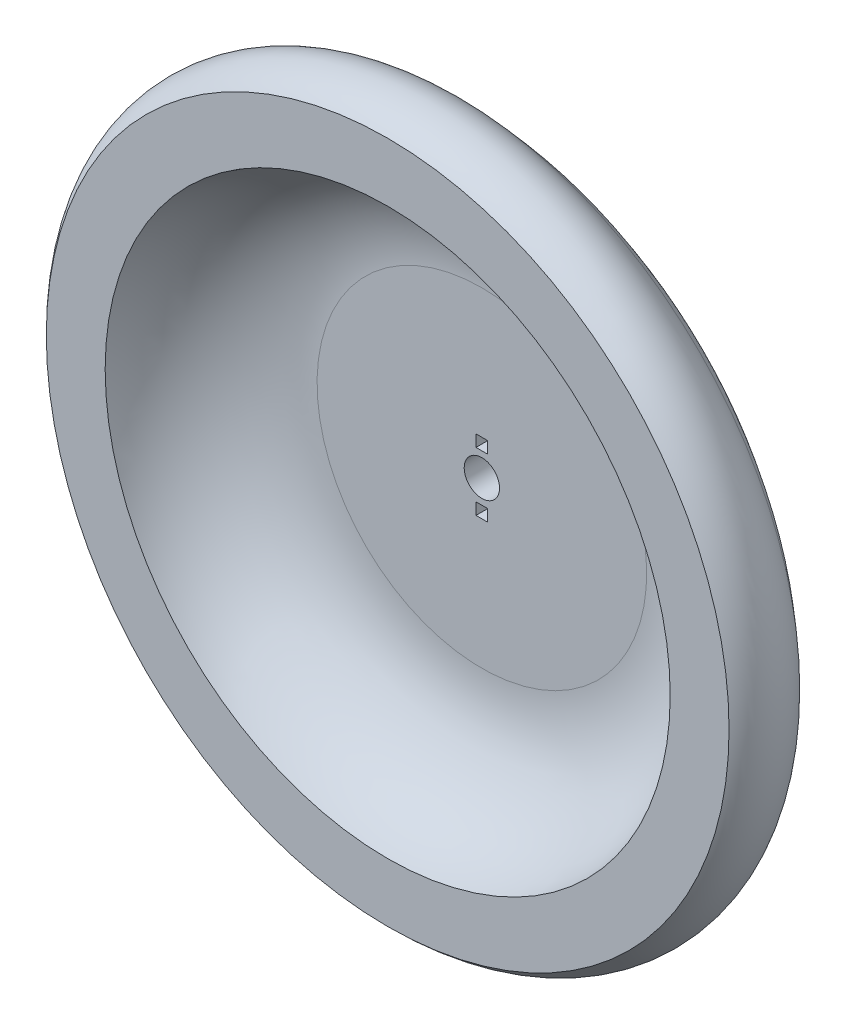
from build123d import *

# Parameters (mm, degrees)
F_3_0MM_DOWEL_HOLE1_D           = 3
F_3_0MM_DOWEL_HOLE1_ON_FACE_2_D = 3
SKETCH5_W                       = 1
SKETCH5_H                       = 1
AXIAL_TRANSMISION_DEPTH         = 2


with BuildPart() as part:
    # Sketch1 → Revolve1 (revolve)
    with BuildSketch(Plane(origin=(0, 0, 0), x_dir=(0, 0, -1), z_dir=(1, 0, 0))):
        with BuildLine():
            Line((15, 0), (15, 14))
            ThreePointArc((15, 14), (13.444368027, 22.077747211), (9, 29))
            ThreePointArc((9, 29), (6, 30.285714286), (3, 29))
            Line((3, 29), (3, 24))
            ThreePointArc((3, 24), (8.753905297, 20.403124237), (11, 14))
            Line((11, 14), (11, 0))
            Line((11, 0), (15, 0))
        make_face()
    revolve(axis=Axis((0, 0, -15), (0, 0, 1)))

    # Ø3.0mm Dowel Hole1 (through all)
    with Locations(Plane(origin=(0, 0, -15), x_dir=(0, -1, 0), z_dir=(0, 0, -1))):
        with Locations((0, 0)):
            Hole(F_3_0MM_DOWEL_HOLE1_D / 2)

    # Ø3.0mm Dowel Hole1 on face 2 (through all)
    with Locations(Plane(origin=(0, 0, 0), x_dir=(0, -1, 0), z_dir=(0, 0, -1))):
        with Locations((0, 0)):
            Hole(F_3_0MM_DOWEL_HOLE1_ON_FACE_2_D / 2)

    # Sketch5 → Axial_Transmision (cut)
    with BuildSketch(Plane.XY.offset(-11)):
        with Locations((0, 2.5)):
            Rectangle(SKETCH5_W, SKETCH5_H)
        with Locations((0, -2.5)):
            Rectangle(SKETCH5_W, SKETCH5_H)
    extrude(amount=-AXIAL_TRANSMISION_DEPTH, mode=Mode.SUBTRACT)


solid = part.part
